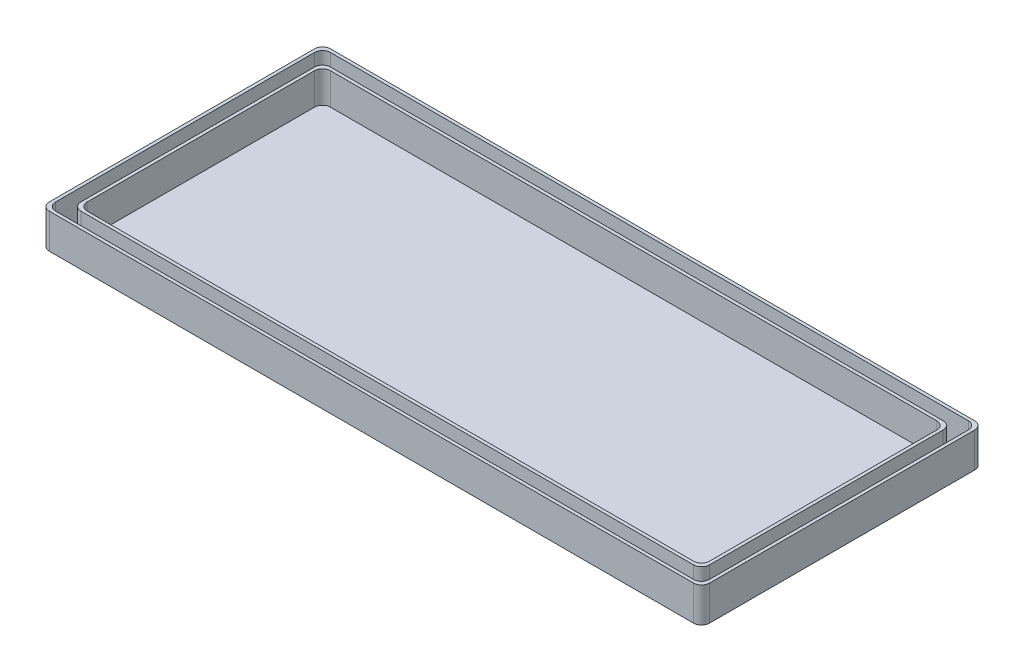
from build123d import *

# Parameters (mm, degrees)
ESBO_O1_W                = 82.8
ESBO_O1_H                = 34.8
RESSALTO_EXTRUS_O1_DEPTH = 4
CASCA2_T                 = 0.4
ESBO_O2_W                = 79.6
ESBO_O2_H                = 31.6
ESBO_O2_W_2              = 78.8
ESBO_O2_H_2              = 30.8
RESSALTO_EXTRUS_O2_DEPTH = 4
FILETE1_R                = 1


with BuildPart() as part:
    # Esboço1 → Ressalto-extrusão1 (new body)
    with BuildSketch(Plane(origin=(0, 0, 0), x_dir=(1, 0, 0), z_dir=(0, 1, 0))):
        Rectangle(ESBO_O1_W, ESBO_O1_H)
    extrude(amount=RESSALTO_EXTRUS_O1_DEPTH)

    # Casca2
    casca2_openings = [part.faces().sort_by_distance(p)[0] for p in [
        (0, 4, 0),
    ]]
    offset(amount=CASCA2_T, openings=casca2_openings, kind=Kind.INTERSECTION)

    # Esboço2 → Ressalto-extrusão2 (add)
    with BuildSketch(Plane(origin=(0, 0, 0), x_dir=(1, 0, 0), z_dir=(0, 1, 0))):
        Rectangle(ESBO_O2_W, ESBO_O2_H)
        Rectangle(ESBO_O2_W_2, ESBO_O2_H_2, mode=Mode.SUBTRACT)
    extrude(amount=RESSALTO_EXTRUS_O2_DEPTH)

    # Filete1
    filete1_edges = [part.edges().sort_by_distance(p)[0] for p in [
        (-41.4, 2, -17.4),
        (-41.4, 2, 17.4),
        (41.4, 2, 17.4),
        (41.4, 2, -17.4),
        (39.8, 2, -15.8),
        (-39.8, 2, -15.8),
        (-39.8, 2, 15.8),
        (39.8, 2, 15.8),
        (-39.4, 2, -15.4),
        (-39.4, 2, 15.4),
        (39.4, 2, 15.4),
        (39.4, 2, -15.4),
        (-41.8, 1.8, -17.8),
        (41.8, 1.8, -17.8),
        (41.8, 1.8, 17.8),
        (-41.8, 1.8, 17.8),
    ]]
    fillet(filete1_edges, radius=FILETE1_R)


solid = part.part
